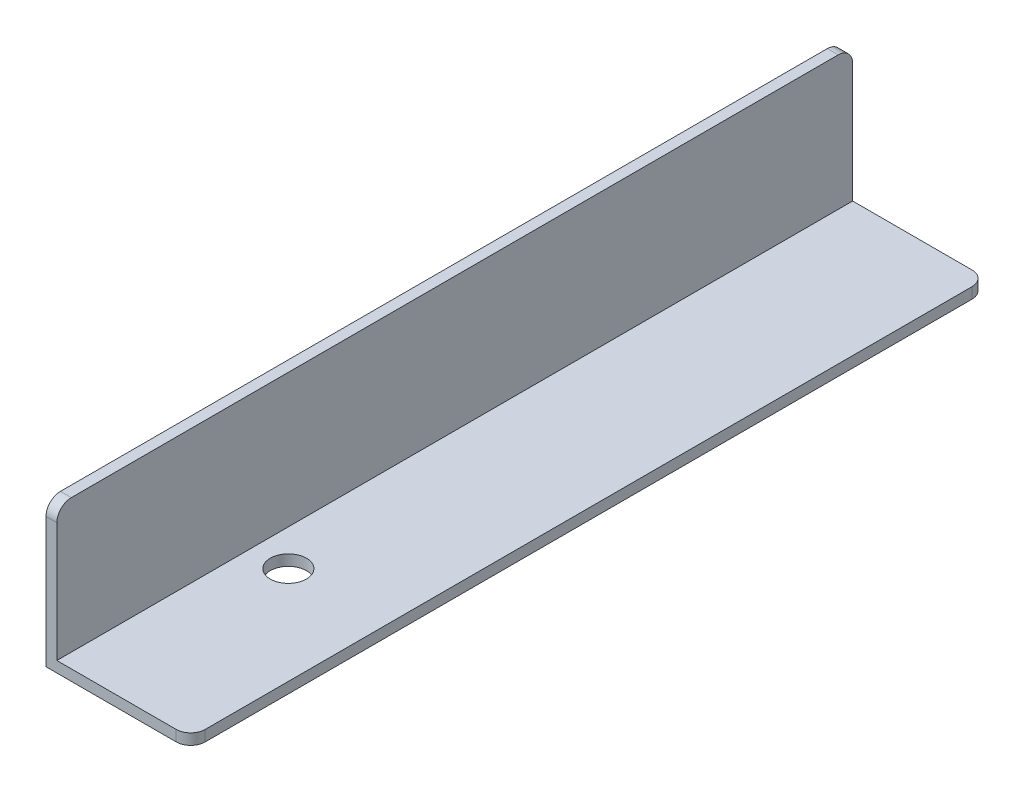
from build123d import *

# Parameters (mm, degrees)
LINEAR_AUSTRAGEN_D_NN1_DEPTH    = 110
SKIZZE2_R                       = 2.5
SCHNITT_LINEAR_AUSTRAGEN1_DEPTH = 17
VERRUNDUNG1_R                   = 2


with BuildPart() as part:
    # Skizze1 → Linear-Austragen-Dünn1 (new body)
    with BuildSketch(Plane.XY):
        Polygon((0, 20), (0, 0), (20, 0), (20, 1.5), (1.5, 1.5), (1.5, 20), align=None)
    extrude(amount=-LINEAR_AUSTRAGEN_D_NN1_DEPTH)

    # Skizze2 → Schnitt-Linear austragen1 (cut)
    with BuildSketch(Plane.XZ):
        with Locations(Location((6.5, -27, 0), (0, 0, 270))):
            Circle(SKIZZE2_R)
    extrude(amount=-SCHNITT_LINEAR_AUSTRAGEN1_DEPTH, mode=Mode.SUBTRACT)

    # Verrundung1
    verrundung1_edges = [part.edges().sort_by_distance(p)[0] for p in [
        (0.75, 20, -110),
        (0.75, 20, 0),
        (20, 0.75, 0),
        (20, 0.75, -110),
    ]]
    fillet(verrundung1_edges, radius=VERRUNDUNG1_R)


solid = part.part
